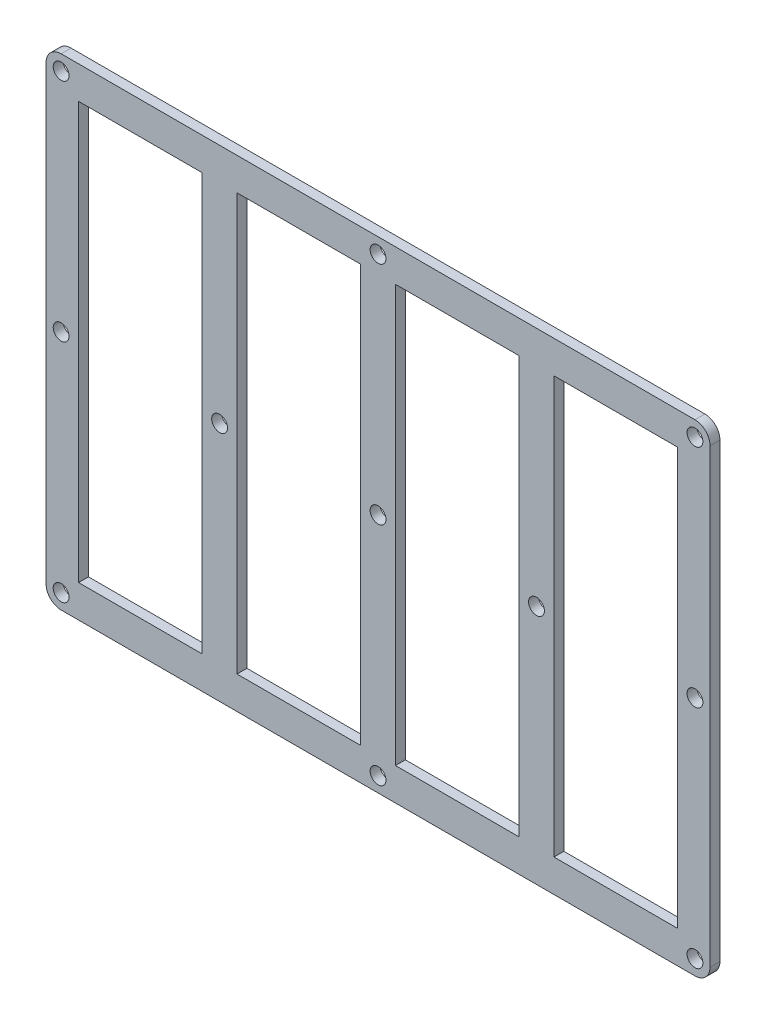
from build123d import *

# Parameters (mm, degrees)
SKETCH1_R           = 2.54
SKETCH1_W           = 39.624
SKETCH1_H           = 133.604
BOSS_EXTRUDE1_DEPTH = 3.175


with BuildPart() as part:
    # Sketch1 → Boss-Extrude1 (new body)
    with BuildSketch(Plane.XY):
        with BuildLine():
            Line((106.426, 24.765), (106.426, 72.39))
            ThreePointArc((106.426, 72.39), (105.012497326, 75.802497326), (101.6, 77.216))
            Line((101.6, 77.216), (-101.6, 77.216))
            ThreePointArc((-101.6, 77.216), (-105.012497326, 75.802497326), (-106.426, 72.39))
            Line((-106.426, 72.39), (-106.426, 24.765))
            Line((-106.426, 24.765), (-106.426, -24.765))
            Line((-106.426, -24.765), (-106.426, -72.39))
            ThreePointArc((-106.426, -72.39), (-105.012497326, -75.802497326), (-101.6, -77.216))
            Line((-101.6, -77.216), (101.6, -77.216))
            ThreePointArc((101.6, -77.216), (105.012497326, -75.802497326), (106.426, -72.39))
            Line((106.426, -72.39), (106.426, -24.765))
            Line((106.426, -24.765), (106.426, 24.765))
        make_face()
        with Locations((-101.6, -72.39)):
            Circle(SKETCH1_R, mode=Mode.SUBTRACT)
        with Locations((0, -72.39)):
            Circle(SKETCH1_R, mode=Mode.SUBTRACT)
        with Locations((25.4, 0)):
            Rectangle(SKETCH1_W, SKETCH1_H, mode=Mode.SUBTRACT)
        with Locations((101.6, -72.39)):
            Circle(SKETCH1_R, mode=Mode.SUBTRACT)
        with Locations((-101.6, 0)):
            Circle(SKETCH1_R, mode=Mode.SUBTRACT)
        with Locations((-76.2, 0)):
            Rectangle(SKETCH1_W, SKETCH1_H, mode=Mode.SUBTRACT)
        with Locations((-101.6, 72.39)):
            Circle(SKETCH1_R, mode=Mode.SUBTRACT)
        with Locations((-50.8, 0)):
            Circle(SKETCH1_R, mode=Mode.SUBTRACT)
        with Locations((-25.4, 0)):
            Rectangle(SKETCH1_W, SKETCH1_H, mode=Mode.SUBTRACT)
        Circle(SKETCH1_R, mode=Mode.SUBTRACT)
        with Locations((50.8, 0)):
            Circle(SKETCH1_R, mode=Mode.SUBTRACT)
        with Locations((0, 72.39)):
            Circle(SKETCH1_R, mode=Mode.SUBTRACT)
        with Locations((76.2, 0)):
            Rectangle(SKETCH1_W, SKETCH1_H, mode=Mode.SUBTRACT)
        with Locations((101.6, 0)):
            Circle(SKETCH1_R, mode=Mode.SUBTRACT)
        with Locations((101.6, 72.39)):
            Circle(SKETCH1_R, mode=Mode.SUBTRACT)
    extrude(amount=BOSS_EXTRUDE1_DEPTH)


solid = part.part
